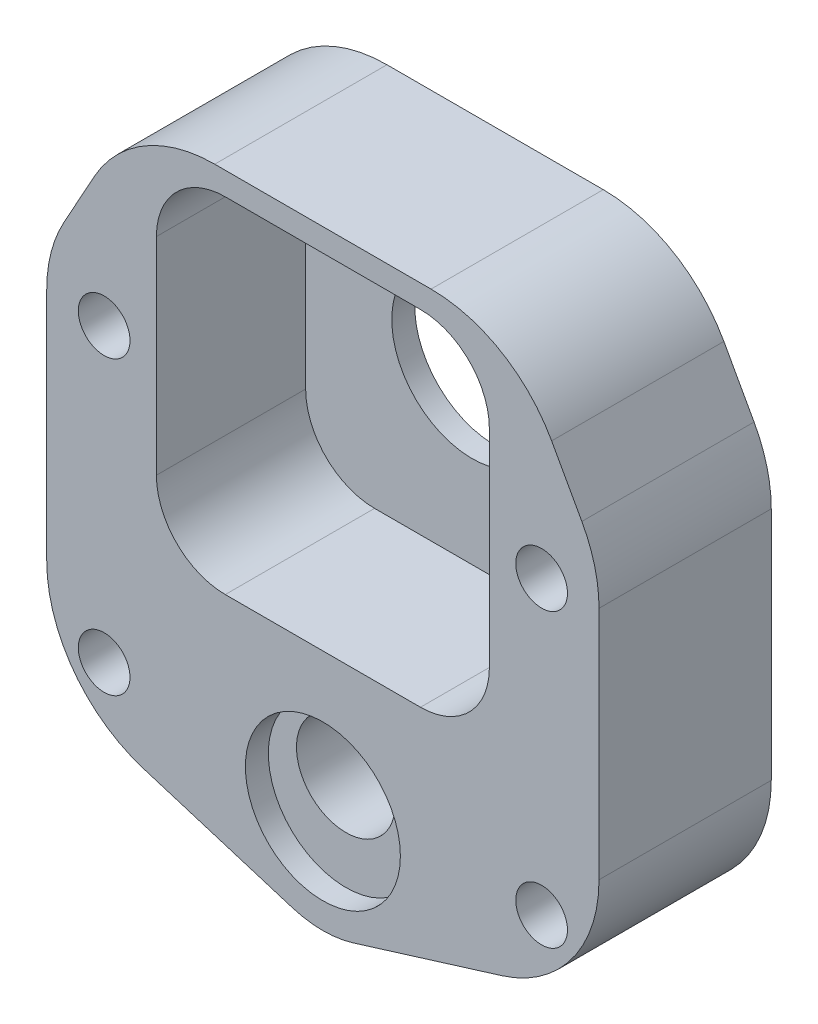
from build123d import *

# Parameters (mm, degrees)
SKETCH3_R           = 2.25
SKETCH3_W           = 29
SKETCH3_H           = 30
SKETCH3_R_2         = 9
SKETCH3_R_3         = 6.75
SKETCH3_R_4         = 4.3
BOSS_EXTRUDE1_DEPTH = 15
SKETCH3_3_W         = 29
SKETCH3_3_H         = 30
SKETCH3_3_R         = 7
BOSS_EXTRUDE2_DEPTH = 2
CUT_EXTRUDE1_START  = 13
SKETCH3_4_R         = 6.75
SKETCH3_4_R_2       = 4.3
CUT_EXTRUDE1_DEPTH  = 2
FILLET1_R           = 6
FILLET2_R           = 12


with BuildPart() as part:
    # Sketch3 → Boss-Extrude1 (new body)
    # profile 1 of 3: a face of its own
    with BuildSketch(Plane.XY):
        with BuildLine():
            Line((16.5, 17), (-16.5, 17))
            Line((-16.5, 17), (-24.05, 3.333333333))
            Line((-24.05, 3.333333333), (-24.05, -29.088230031))
            Line((-24.05, -29.088230031), (-2.657112786, -35.698822689))
            ThreePointArc((-2.657112786, -35.698822689), (-5.342564222, -19.857278996), (9, -27.1))
            ThreePointArc((9, -27.1), (7.242721004, -32.442564222), (2.657112786, -35.698822689))
            Line((2.657112786, -35.698822689), (24.05, -29.088230031))
            Line((24.05, -29.088230031), (24.05, 3.333333333))
            Line((24.05, 3.333333333), (16.5, 17))
        make_face()
        with Locations((-19.05, -25.4)):
            Circle(SKETCH3_R, mode=Mode.SUBTRACT)
        with Locations((19.05, -25.4)):
            Circle(SKETCH3_R, mode=Mode.SUBTRACT)
        with Locations((-19.05, 0)):
            Circle(SKETCH3_R, mode=Mode.SUBTRACT)
        Rectangle(SKETCH3_W, SKETCH3_H, mode=Mode.SUBTRACT)
        with Locations((19.05, 0)):
            Circle(SKETCH3_R, mode=Mode.SUBTRACT)
    # profile 2 of 3: a face of its own
    with BuildSketch(Plane.XY):
        with Locations((0, -27.1)):
            Circle(SKETCH3_R_2)
        with Locations((0, -27.1)):
            Circle(SKETCH3_R_3, mode=Mode.SUBTRACT)
    # profile 3 of 3: a face of its own
    with BuildSketch(Plane.XY):
        with Locations((0, -27.1)):
            Circle(SKETCH3_R_3)
        with Locations((0, -25.4)):
            Circle(SKETCH3_R_4, mode=Mode.SUBTRACT)
    extrude(amount=BOSS_EXTRUDE1_DEPTH)

    # Sketch3<3> → Boss-Extrude2 (add)
    with BuildSketch(Plane.XY):
        Rectangle(SKETCH3_3_W, SKETCH3_3_H)
        Circle(SKETCH3_3_R, mode=Mode.SUBTRACT)
    extrude(amount=BOSS_EXTRUDE2_DEPTH)

    # Sketch3<4> → Cut-Extrude1 (cut)
    with BuildSketch(Plane.XY.offset(CUT_EXTRUDE1_START)):
        with Locations((0, -27.1)):
            Circle(SKETCH3_4_R)
        with Locations((0, -25.4)):
            Circle(SKETCH3_4_R_2, mode=Mode.SUBTRACT)
    extrude(amount=CUT_EXTRUDE1_DEPTH, mode=Mode.SUBTRACT)

    # Fillet1
    fillet1_edges = [part.edges().sort_by_distance(p)[0] for p in [
        (-14.5, 15, 8.5),
        (-14.5, -15, 8.5),
        (14.5, -15, 8.5),
        (14.5, 15, 8.5),
    ]]
    fillet(fillet1_edges, radius=FILLET1_R)

    # Fillet2
    fillet2_edges = [part.edges().sort_by_distance(p)[0] for p in [
        (-24.05, -29.088230031, 7.5),
        (-24.05, 3.333333333, 7.5),
        (-16.5, 17, 7.5),
        (16.5, 17, 7.5),
        (24.05, 3.333333333, 7.5),
        (24.05, -29.088230031, 7.5),
    ]]
    fillet(fillet2_edges, radius=FILLET2_R)


solid = part.part
